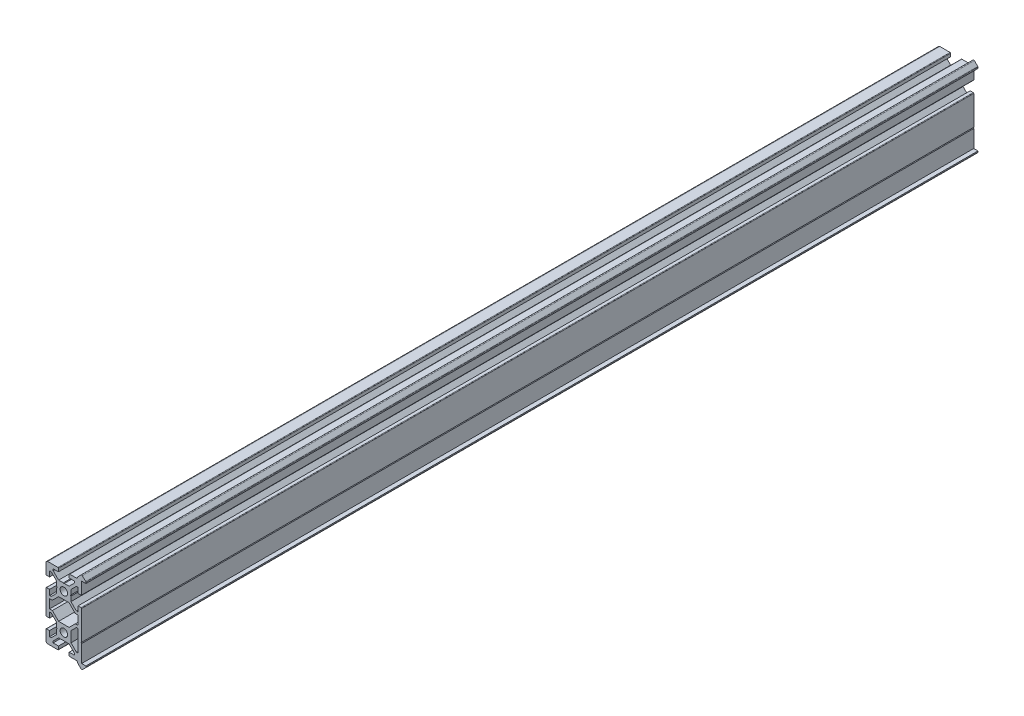
from build123d import *

# Parameters (mm, degrees)
SKETCH1_R           = 2.1
BOSS_EXTRUDE1_DEPTH = 500


with BuildPart() as part:
    # Sketch1 → Boss-Extrude1 (new body)
    with BuildSketch(Plane(origin=(0, 0, 0), x_dir=(-1, 0, 0), z_dir=(0, 0, -1))):
        with BuildLine():
            Line((-9.646446609, -22.821446609), (-7.771446609, -20.946446609))
            ThreePointArc((-7.771446609, -20.946446609), (-7.663060234, -20.784234935), (-7.625, -20.592893219))
            Line((-7.625, -20.592893219), (-7.625, -20.5))
            ThreePointArc((-7.625, -20.5), (-7.478553391, -20.146446609), (-7.125, -20))
            Line((-7.125, -20), (-3.3, -20))
            ThreePointArc((-3.3, -20), (-3.087867966, -19.912132034), (-3, -19.7))
            Line((-3, -19.7), (-3, -18))
            Line((-3, -18), (-6, -18))
            Line((-6, -18), (-6, -17.060660172))
            Line((-6, -17.060660172), (-2.939339828, -14))
            Line((-2.939339828, -14), (-0.3, -14))
            Line((-0.3, -14), (0, -13.7))
            Line((0, -13.7), (0.3, -14))
            Line((0.3, -14), (2.939339828, -14))
            Line((2.939339828, -14), (6, -17.060660172))
            Line((6, -17.060660172), (6, -18))
            Line((6, -18), (3, -18))
            Line((3, -18), (3, -19.7))
            ThreePointArc((3, -19.7), (3.087867966, -19.912132034), (3.3, -20))
            Line((3.3, -20), (9, -20))
            ThreePointArc((9, -20), (9.707106781, -19.707106781), (10, -19))
            Line((10, -19), (10, -13.3))
            ThreePointArc((10, -13.3), (9.912132034, -13.087867966), (9.7, -13))
            Line((9.7, -13), (8, -13))
            Line((8, -13), (8, -16))
            Line((8, -16), (7.060660172, -16))
            Line((7.060660172, -16), (4, -12.939339828))
            Line((4, -12.939339828), (4, -10.3))
            Line((4, -10.3), (3.7, -10))
            Line((3.7, -10), (4, -9.7))
            Line((4, -9.7), (4, -7.060660172))
            Line((4, -7.060660172), (7.060660172, -4))
            Line((7.060660172, -4), (8, -4))
            Line((8, -4), (8, -7))
            Line((8, -7), (9.7, -7))
            ThreePointArc((9.7, -7), (9.912132034, -6.912132034), (10, -6.7))
            Line((10, -6.7), (10, 6.7))
            ThreePointArc((10, 6.7), (9.912132034, 6.912132034), (9.7, 7))
            Line((9.7, 7), (8, 7))
            Line((8, 7), (8, 4))
            Line((8, 4), (7.060660172, 4))
            Line((7.060660172, 4), (4, 7.060660172))
            Line((4, 7.060660172), (4, 9.7))
            Line((4, 9.7), (3.7, 10))
            Line((3.7, 10), (4, 10.3))
            Line((4, 10.3), (4, 12.939339828))
            Line((4, 12.939339828), (7.060660172, 16))
            Line((7.060660172, 16), (8, 16))
            Line((8, 16), (8, 13))
            Line((8, 13), (9.7, 13))
            ThreePointArc((9.7, 13), (9.912132034, 13.087867966), (10, 13.3))
            Line((10, 13.3), (10, 19))
            ThreePointArc((10, 19), (9.707106781, 19.707106781), (9, 20))
            Line((9, 20), (3.300000001, 20))
            ThreePointArc((3.300000001, 20), (3.087867966, 19.912132034), (3, 19.699999999))
            Line((3, 19.699999999), (3, 18))
            Line((3, 18), (6, 18))
            Line((6, 18), (6, 17.060660172))
            Line((6, 17.060660172), (2.939339828, 14))
            Line((2.939339828, 14), (0.3, 14))
            Line((0.3, 14), (0, 13.7))
            Line((0, 13.7), (-0.3, 14))
            Line((-0.3, 14), (-2.939339828, 14))
            Line((-2.939339828, 14), (-6, 17.060660172))
            Line((-6, 17.060660172), (-6, 18))
            Line((-6, 18), (-3, 18))
            Line((-3, 18), (-3, 19.7))
            ThreePointArc((-3, 19.7), (-3.087867966, 19.912132034), (-3.3, 20))
            Line((-3.3, 20), (-7.125, 20))
            ThreePointArc((-7.125, 20), (-7.478553391, 20.146446609), (-7.625, 20.5))
            Line((-7.625, 20.5), (-7.625, 20.592893219))
            ThreePointArc((-7.625, 20.592893219), (-7.663060234, 20.784234935), (-7.771446609, 20.946446609))
            Line((-7.771446609, 20.946446609), (-9.646446609, 22.821446609))
            ThreePointArc((-9.646446609, 22.821446609), (-10, 22.967893219), (-10.353553391, 22.821446609))
            Line((-10.353553391, 22.821446609), (-12.228553391, 20.946446609))
            ThreePointArc((-12.228553391, 20.946446609), (-12.336939766, 20.784234935), (-12.375, 20.592893219))
            Line((-12.375, 20.592893219), (-12.375, 20))
            Line((-12.375, 20), (-10, 20))
            Line((-10, 20), (-10, 13.3))
            ThreePointArc((-10, 13.3), (-9.912132034, 13.087867966), (-9.7, 13))
            Line((-9.7, 13), (-8, 13))
            Line((-8, 13), (-8, 16))
            Line((-8, 16), (-7.060660172, 16))
            Line((-7.060660172, 16), (-4, 12.939339828))
            Line((-4, 12.939339828), (-4, 10.3))
            Line((-4, 10.3), (-3.7, 10))
            Line((-3.7, 10), (-4, 9.7))
            Line((-4, 9.7), (-4, 7.060660172))
            Line((-4, 7.060660172), (-7.060660172, 4))
            Line((-7.060660172, 4), (-8, 4))
            Line((-8, 4), (-8, 7))
            Line((-8, 7), (-9.7, 7))
            ThreePointArc((-9.7, 7), (-9.912132034, 6.912132034), (-10, 6.7))
            Line((-10, 6.7), (-10, -9.7))
            Line((-10, -9.7), (-9.7, -10))
            Line((-9.7, -10), (-10, -10.3))
            Line((-10, -10.3), (-10, -20))
            Line((-10, -20), (-12.375, -20))
            Line((-12.375, -20), (-12.375, -20.592893219))
            ThreePointArc((-12.375, -20.592893219), (-12.336939766, -20.784234935), (-12.228553391, -20.946446609))
            Line((-12.228553391, -20.946446609), (-10.353553391, -22.821446609))
            ThreePointArc((-10.353553391, -22.821446609), (-10, -22.967893219), (-9.646446609, -22.821446609))
        make_face()
        with Locations(Location((0, 10, 0), (0, 0, 180))):
            Circle(SKETCH1_R, mode=Mode.SUBTRACT)
        with Locations(Location((0, -10, 0), (0, 0, 180))):
            Circle(SKETCH1_R, mode=Mode.SUBTRACT)
        Polygon((-8, -4), (-7.060660172, -4), (-4, -7.060660172), (-4, -12.939339828), (-7.060660172, -16), (-8, -16), align=None, mode=Mode.SUBTRACT)
        Polygon((8, -2.5), (6.439339828, -2.5), (2.939339828, -6), (-2.939339828, -6), (-6.439339828, -2.5), (-8, -2.5), (-8, 2.5), (-6.439339828, 2.5), (-2.939339828, 6), (2.939339828, 6), (6.439339828, 2.5), (8, 2.5), align=None, mode=Mode.SUBTRACT)
    extrude(amount=-BOSS_EXTRUDE1_DEPTH)


solid = part.part
